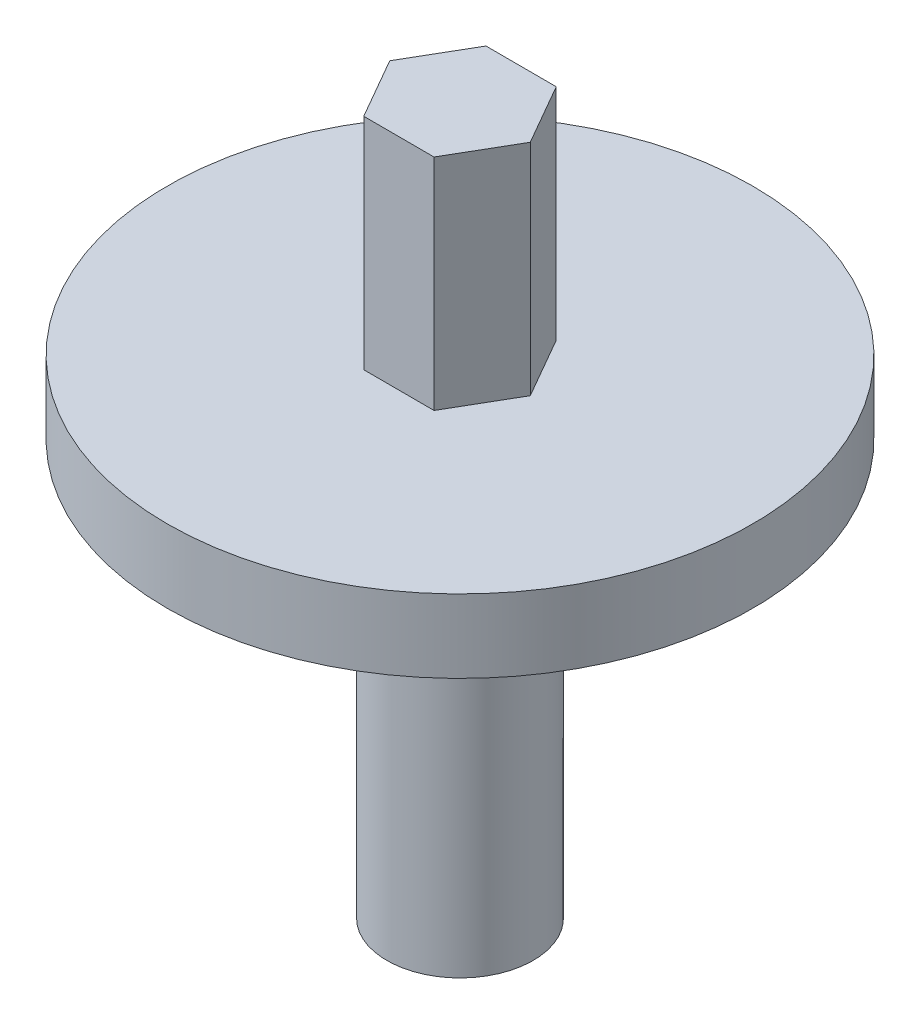
from build123d import *

# Parameters (mm, degrees)
CUT_EXTRUDE_START   = -9
SKETCH_2_R          = 3
CUT_EXTRUDE_2_DEPTH = 9


with BuildPart() as part:
    # ｽｹｯﾁ1 → 回転1 (revolve)
    with BuildSketch(Plane.XY, mode=Mode.PRIVATE) as revolve_1_sk:
        Polygon((0, 0), (0, 29), (3, 29), (3, 20), (12, 20), (12, 17), (3, 17), (3, 0), align=None)
    revolve(revolve_1_sk.sketch.rotate(Axis((0, 0, 0), (0, 1, 0)), 90), axis=Axis((0, 0, 0), (0, 1, 0)))

    # ｽｹｯﾁ2 → ｶｯﾄ - 押し出し2 (cut)
    with BuildSketch(Plane(origin=(0, 29, 0), x_dir=(1, 0, 0), z_dir=(0, 1, 0)).offset(CUT_EXTRUDE_START)):
        with Locations(Location((0, 0, 0), (0, 0, 90))):
            Circle(SKETCH_2_R)
        Polygon((1.437961457, -2.503118092), (2.886744585, -0.006247894), (1.448783128, 2.496870197), (-1.437961457, 2.503118092), (-2.886744585, 0.006247894), (-1.448783128, -2.496870197), align=None, mode=Mode.SUBTRACT)
    extrude(amount=CUT_EXTRUDE_2_DEPTH, mode=Mode.SUBTRACT)


solid = part.part
